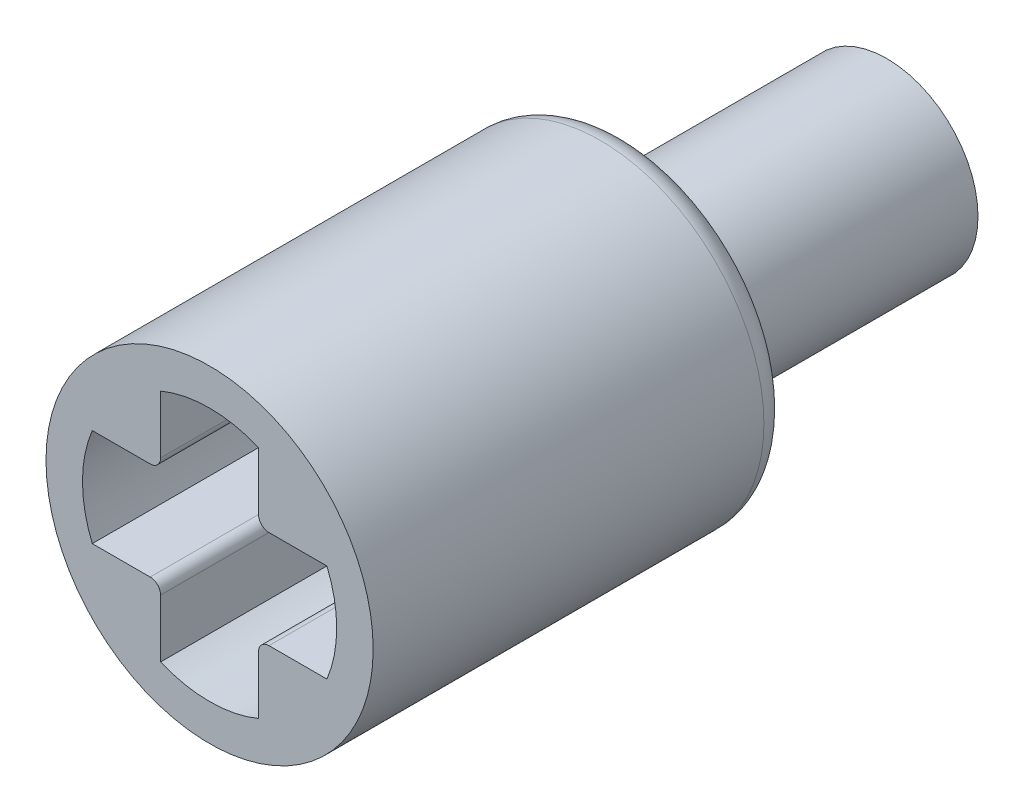
from build123d import *

# Parameters (mm, degrees)
SKETCH1_R           = 1.75
SKETCH1_R_2         = 1
BOSS_EXTRUDE1_DEPTH = 5
SKETCH2_R           = 3.14
BOSS_EXTRUDE2_DEPTH = 1
SKETCH2_4_R         = 3.14
BOSS_EXTRUDE3_DEPTH = 8
FILLET1_R           = 0.5
FILLET2_R           = 0.2


with BuildPart() as part:
    # Sketch1 → Boss-Extrude1 (new body)
    with BuildSketch(Plane.XY):
        Circle(SKETCH1_R)
        Circle(SKETCH1_R_2, mode=Mode.SUBTRACT)
    extrude(amount=BOSS_EXTRUDE1_DEPTH)

    # Sketch2 → Boss-Extrude2 (add)
    with BuildSketch(Plane.XY.offset(5)):
        Circle(SKETCH2_R)
    extrude(amount=BOSS_EXTRUDE2_DEPTH)

    # Sketch2<4> → Boss-Extrude3 (add)
    with BuildSketch(Plane.XY.offset(5)):
        Circle(SKETCH2_4_R)
        with BuildLine():
            Line((0.94, 0.94), (2.25166605, 0.94))
            ThreePointArc((2.25166605, 0.94), (2.44, 0), (2.25166605, -0.94))
            Line((2.25166605, -0.94), (0.94, -0.94))
            Line((0.94, -0.94), (0.94, -2.25166605))
            ThreePointArc((0.94, -2.25166605), (0, -2.44), (-0.94, -2.25166605))
            Line((-0.94, -2.25166605), (-0.94, -0.94))
            Line((-0.94, -0.94), (-2.25166605, -0.94))
            ThreePointArc((-2.25166605, -0.94), (-2.44, 0), (-2.25166605, 0.94))
            Line((-2.25166605, 0.94), (-0.94, 0.94))
            Line((-0.94, 0.94), (-0.94, 2.25166605))
            ThreePointArc((-0.94, 2.25166605), (0, 2.44), (0.94, 2.25166605))
            Line((0.94, 2.25166605), (0.94, 0.94))
        make_face(mode=Mode.SUBTRACT)
    extrude(amount=BOSS_EXTRUDE3_DEPTH)

    # Fillet1
    fillet1_edges = [part.edges().sort_by_distance(p)[0] for p in [
        (-3.14, 0, 5),
        (-1.75, 0, 5),
    ]]
    fillet(fillet1_edges, radius=FILLET1_R)

    # Fillet2
    fillet2_edges = [part.edges().sort_by_distance(p)[0] for p in [
        (-0.94, 0.94, 9.5),
        (0.94, 0.94, 9.5),
        (0.94, -0.94, 9.5),
        (-0.94, -0.94, 9.5),
    ]]
    fillet(fillet2_edges, radius=FILLET2_R)


solid = part.part
